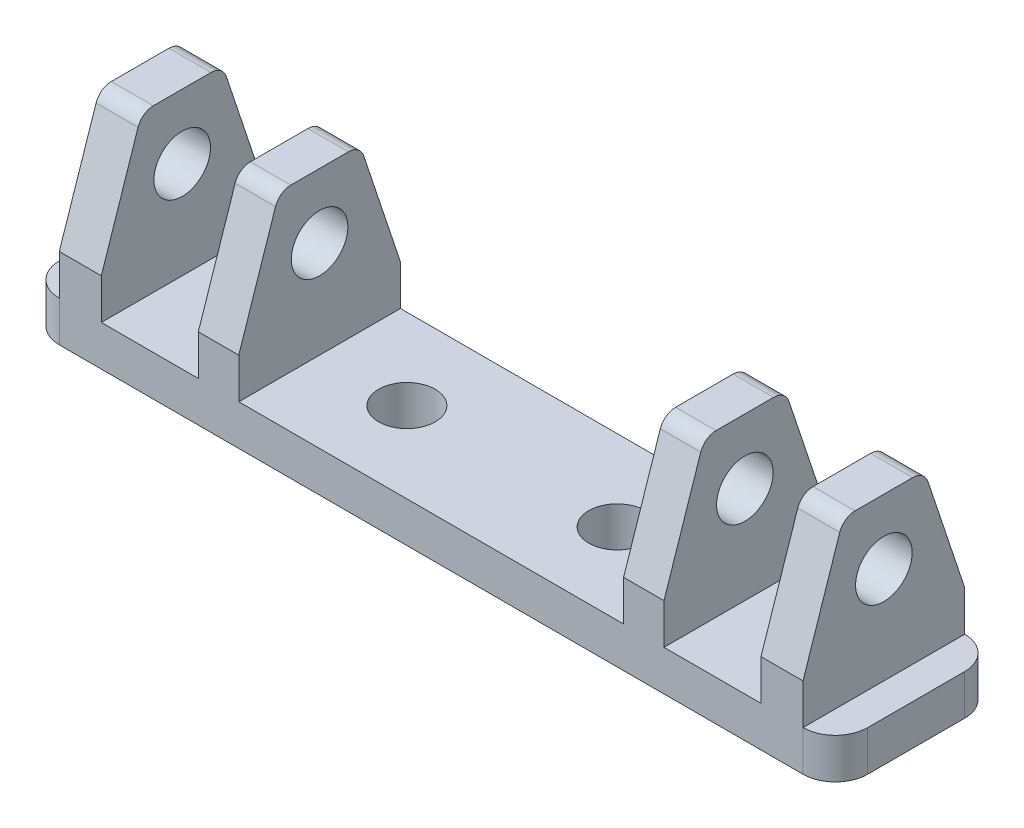
from build123d import *

# Parameters (mm, degrees)
EXTRUDE_1_DEPTH     = 2.5
SKETCH_3_W          = 2.599185832
SKETCH_3_H          = 10
SKETCH_3_W_2        = 2.5
EXTRUDE_2_DEPTH     = 10
CUT_EXTRUDE_1_DEPTH = 59
SKETCH_5_R          = 1.75
CUT_EXTRUDE_2_DEPTH = 59
FILLET_1_R          = 1
SKETCH_6_R          = 1.75
CUT_EXTRUDE_3_DEPTH = 59


with BuildPart() as part:
    # 草图1 → 凸台-拉伸1 (new body)
    with BuildSketch(Plane(origin=(0, 0, 0), x_dir=(1, 0, 0), z_dir=(0, 1, 0))):
        with BuildLine():
            Line((-23, -5), (23, -5))
            ThreePointArc((23, -5), (24.414213562, -4.414213562), (25, -3))
            Line((25, -3), (25, 3))
            ThreePointArc((25, 3), (24.414213562, 4.414213562), (23, 5))
            Line((23, 5), (-23, 5))
            ThreePointArc((-23, 5), (-24.414213562, 4.414213562), (-25, 3))
            Line((-25, 3), (-25, -3))
            ThreePointArc((-25, -3), (-24.414213562, -4.414213562), (-23, -5))
        make_face()
    extrude(amount=EXTRUDE_1_DEPTH)

    # 草图3 → 凸台-拉伸2 (add)
    with BuildSketch(Plane(origin=(0, 2.5, 0), x_dir=(1, 0, 0), z_dir=(0, 1, 0))):
        with Locations((-21.700407084, 0)):
            Rectangle(SKETCH_3_W, SKETCH_3_H)
        with Locations((-13.150814168, 0)):
            Rectangle(SKETCH_3_W_2, SKETCH_3_H)
        with Locations((13.150814168, 0)):
            Rectangle(SKETCH_3_W_2, SKETCH_3_H)
        with Locations((21.700407084, 0)):
            Rectangle(SKETCH_3_W, SKETCH_3_H)
    extrude(amount=EXTRUDE_2_DEPTH)

    # 草图4 → 切除-拉伸1 (cut)
    with BuildSketch(Plane.ZY.offset(23)):
        Polygon((-2.5, 12.5), (-5, 5), (-5, 12.5), align=None)
        Polygon((5, 5), (5, 12.5), (2.5, 12.5), align=None)
    extrude(amount=-CUT_EXTRUDE_1_DEPTH, mode=Mode.SUBTRACT)

    # 草图5 → 切除-拉伸2 (cut)
    with BuildSketch(Plane.ZY.offset(23)):
        with Locations(Location((0, 8.5, 0), (0, 0, 180))):
            Circle(SKETCH_5_R)
    extrude(amount=-CUT_EXTRUDE_2_DEPTH, mode=Mode.SUBTRACT)

    # 圆角1
    fillet_1_edges = [part.edges().sort_by_distance(p)[0] for p in [
        (-13.150814168, 12.5, -2.5),
        (13.150814168, 12.5, -2.5),
        (-21.700407084, 12.5, -2.5),
        (-13.150814168, 12.5, 2.5),
        (13.150814168, 12.5, 2.5),
        (-21.700407084, 12.5, 2.5),
        (21.700407084, 12.5, 2.5),
        (21.700407084, 12.5, -2.5),
    ]]
    fillet(fillet_1_edges, radius=FILLET_1_R)

    # 草图6 → 切除-拉伸3 (cut)
    with BuildSketch(Plane(origin=(0, 2.5, 0), x_dir=(1, 0, 0), z_dir=(0, 1, 0))):
        with Locations(Location((-6.5, 0, 0), (0, 0, 270))):
            Circle(SKETCH_6_R)
        with Locations(Location((6.5, 0, 0), (0, 0, 270))):
            Circle(SKETCH_6_R)
    extrude(amount=-CUT_EXTRUDE_3_DEPTH, mode=Mode.SUBTRACT)


solid = part.part
